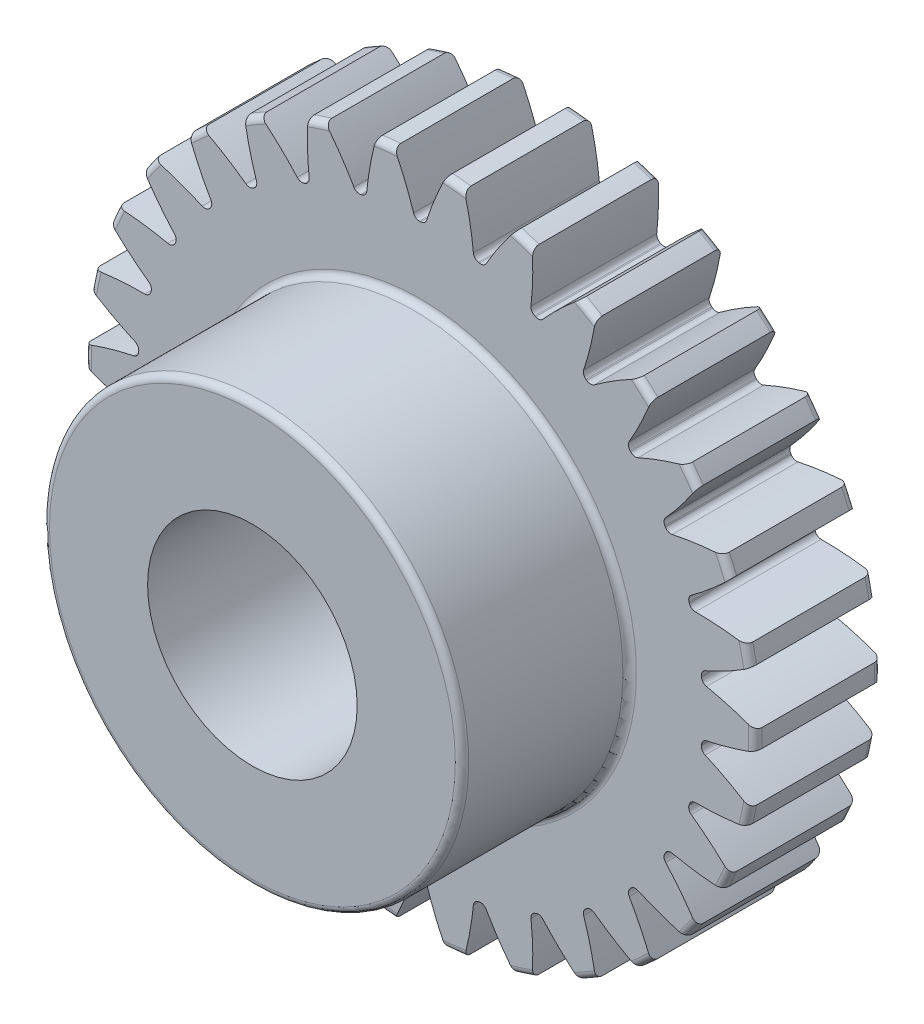
from build123d import *

# Parameters (mm, degrees)
FILLET2_R          = 0.16
CUT_EXTRUDE2_DEPTH = 13
CIRPATTERN1_COUNT  = 30


with BuildPart() as part:
    # Sketch4 → Revolve1 (revolve)
    with BuildSketch(Plane(origin=(0, 0, 0), x_dir=(0, 0, -1), z_dir=(1, 0, 0))):
        Polygon((-7, 2.5), (-7, 5), (-3, 5), (-3, 8), (0, 8), (0, 2.5), align=None)
    revolve(axis=Axis((0, 0, 3), (0, 0, 1)))

    # Fillet2
    fillet2_edges = [part.edges().sort_by_distance(p)[0] for p in [
        (0, -8, 0),
        (0, -8, 3),
        (0, -5, 3),
        (0, -5, 7),
    ]]
    fillet(fillet2_edges, radius=FILLET2_R)

    # Sketch7 → Cut-Extrude2 (cut, through all)
    with BuildSketch(Plane.XY.offset(3)):
        with BuildLine():
            ThreePointArc((-0.012921148, 6.749987633), (0, 6.75), (0.012921148, 6.749987633))
            ThreePointArc((0.012921148, 6.749987633), (0.101459928, 6.778693178), (0.156024335, 6.854097751))
            ThreePointArc((0.156024335, 6.854097751), (0.365165636, 7.424425108), (0.619776866, 7.975956158))
            ThreePointArc((0.619776866, 7.975956158), (0, 8), (-0.619776866, 7.975956158))
            ThreePointArc((-0.619776866, 7.975956158), (-0.365165636, 7.424425108), (-0.156024335, 6.854097751))
            ThreePointArc((-0.156024335, 6.854097751), (-0.101459928, 6.778693178), (-0.012921148, 6.749987633))
        make_face()
    cut_extrude2 = extrude(amount=-CUT_EXTRUDE2_DEPTH, mode=Mode.SUBTRACT)

    # CirPattern1: Cut-Extrude2 ×30 about axis
    cirpattern1_axis = Axis((0, 0, 0), (0, 0, 1))
    for i in range(1, CIRPATTERN1_COUNT):
        add(cut_extrude2.rotate(cirpattern1_axis, i * 360 / CIRPATTERN1_COUNT), mode=Mode.SUBTRACT)


solid = part.part
